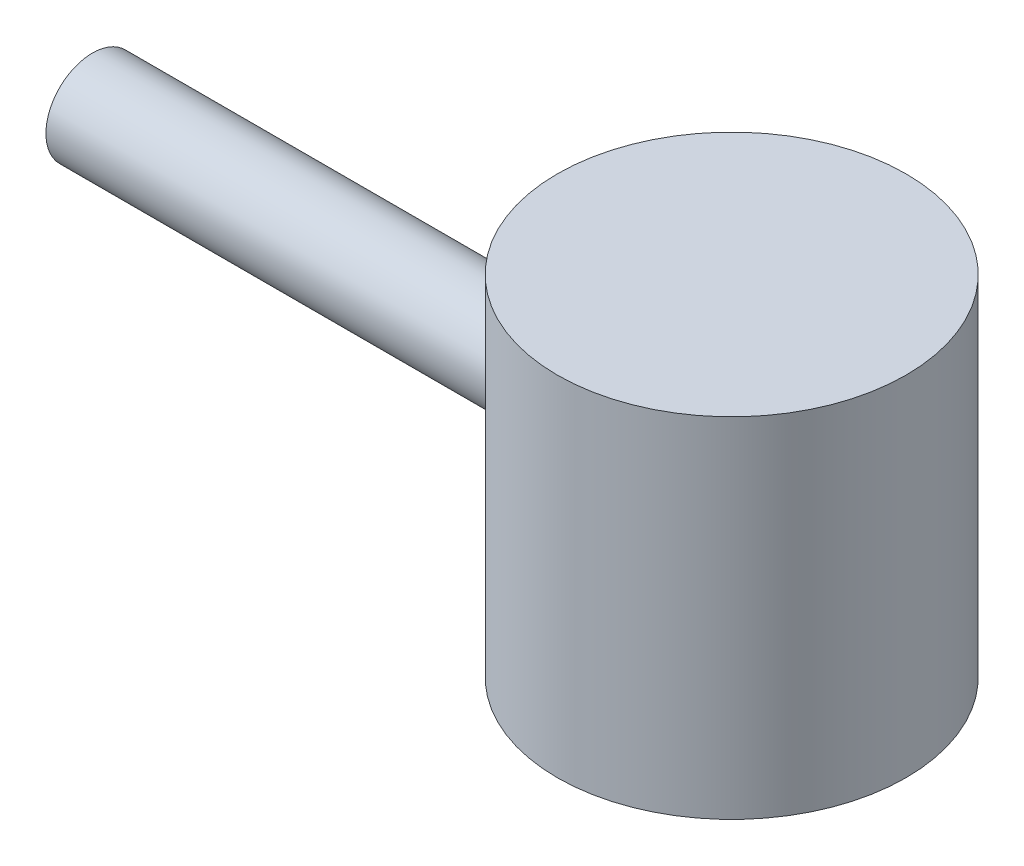
from build123d import *

# Parameters (mm, degrees)
SKETCH1_R           = 7.5
BOSS_EXTRUDE1_DEPTH = 7.5
SKETCH2_R           = 2
BOSS_EXTRUDE2_DEPTH = 27.5


with BuildPart() as part:
    # Sketch1 → Boss-Extrude1 (new, symmetric)
    with BuildSketch(Plane(origin=(0, 0, 0), x_dir=(1, 0, 0), z_dir=(0, 1, 0))):
        with Locations(Location((0, 0, 0), (0, 0, 270))):
            Circle(SKETCH1_R)
    extrude(amount=BOSS_EXTRUDE1_DEPTH, both=True)

    # Sketch2 → Boss-Extrude2 (add)
    with BuildSketch(Plane(origin=(0, 0, 0), x_dir=(0, 0, -1), z_dir=(1, 0, 0))):
        Circle(SKETCH2_R)
    extrude(amount=-BOSS_EXTRUDE2_DEPTH)


solid = part.part
